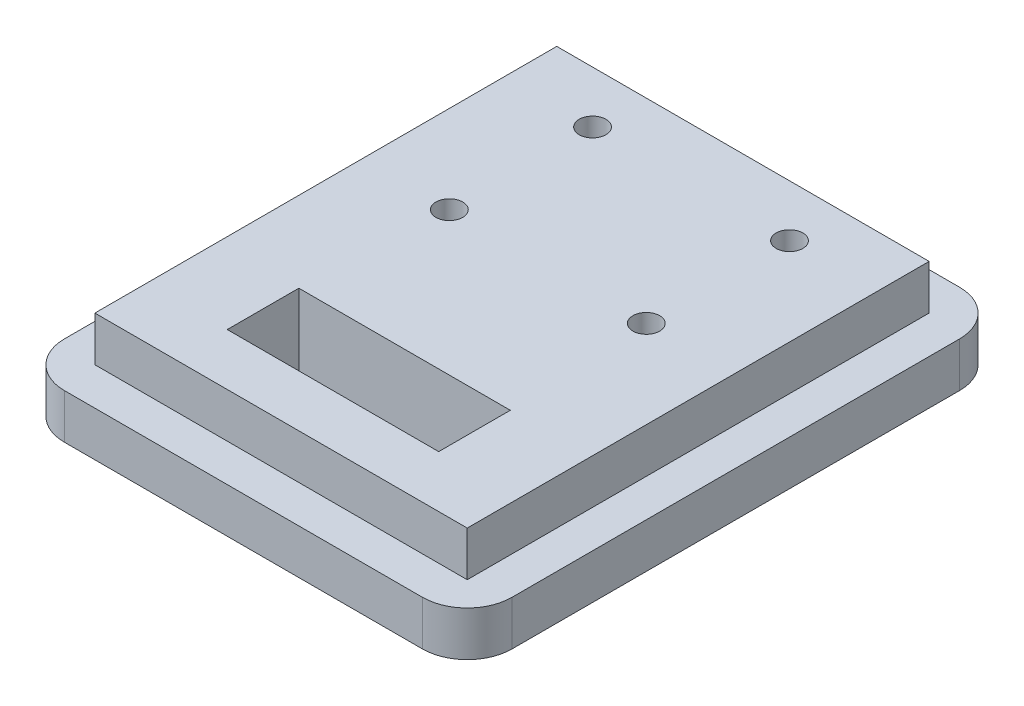
from build123d import *

# Parameters (mm, degrees)
SKETCH1_W           = 31.75
SKETCH1_H           = 38.1
BOSS_EXTRUDE1_DEPTH = 6.35
SKETCH2_R           = 0.95
CUT_EXTRUDE1_DEPTH  = 26.597668351
SKETCH3_W           = 15
SKETCH3_H           = 5.08
CUT_EXTRUDE2_DEPTH  = 26.597668351
SKETCH4_W           = 31.75
SKETCH4_H           = 38.1
SKETCH4_W_2         = 26.416
SKETCH4_H_2         = 32.766
CUT_EXTRUDE3_DEPTH  = 3.175
FILLET1_R           = 3.175


with BuildPart() as part:
    # Sketch1 → Boss-Extrude1 (new body)
    with BuildSketch(Plane(origin=(0, 0, 0), x_dir=(1, 0, 0), z_dir=(0, 1, 0))):
        Rectangle(SKETCH1_W, SKETCH1_H)
    extrude(amount=BOSS_EXTRUDE1_DEPTH)

    # Sketch2 → Cut-Extrude1 (cut, through all)
    with BuildSketch(Plane(origin=(0, 6.35, 0), x_dir=(1, 0, 0), z_dir=(0, 1, 0))):
        with Locations(Location((-6.985, 2.54, 0), (0, 0, 270))):
            Circle(SKETCH2_R)
        with Locations(Location((6.985, 2.54, 0), (0, 0, 270))):
            Circle(SKETCH2_R)
        with Locations(Location((-6.985, 12.7, 0), (0, 0, 270))):
            Circle(SKETCH2_R)
        with Locations(Location((6.985, 12.7, 0), (0, 0, 270))):
            Circle(SKETCH2_R)
    extrude(amount=-CUT_EXTRUDE1_DEPTH, mode=Mode.SUBTRACT)

    # Sketch3 → Cut-Extrude2 (cut, through all)
    with BuildSketch(Plane(origin=(0, 6.35, 0), x_dir=(1, 0, 0), z_dir=(0, 1, 0))):
        with Locations((0, -10.16)):
            Rectangle(SKETCH3_W, SKETCH3_H)
    extrude(amount=-CUT_EXTRUDE2_DEPTH, mode=Mode.SUBTRACT)

    # Sketch4 → Cut-Extrude3 (cut)
    with BuildSketch(Plane(origin=(0, 6.35, 0), x_dir=(1, 0, 0), z_dir=(0, 1, 0))):
        Rectangle(SKETCH4_W, SKETCH4_H)
        Rectangle(SKETCH4_W_2, SKETCH4_H_2, mode=Mode.SUBTRACT)
    extrude(amount=-CUT_EXTRUDE3_DEPTH, mode=Mode.SUBTRACT)

    # Fillet1
    fillet1_edges = [part.edges().sort_by_distance(p)[0] for p in [
        (15.875, 1.5875, 19.05),
        (-15.875, 1.5875, 19.05),
        (-15.875, 1.5875, -19.05),
        (15.875, 1.5875, -19.05),
    ]]
    fillet(fillet1_edges, radius=FILLET1_R)


solid = part.part
